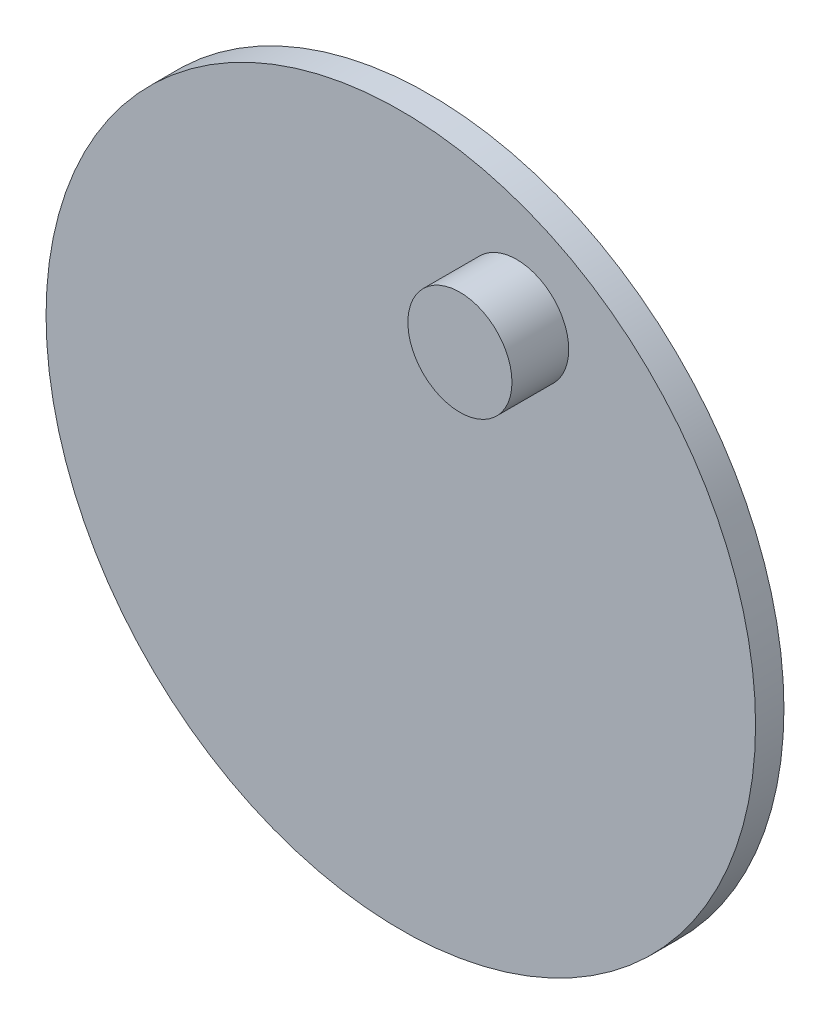
from build123d import *

# Parameters (mm, degrees)
SKETCH1_R           = 75
BOSS_EXTRUDE3_DEPTH = 6
SKETCH5_R           = 11
BOSS_EXTRUDE4_DEPTH = 12


with BuildPart() as part:
    # Sketch1 → Boss-Extrude3 (new body)
    with BuildSketch(Plane.XY):
        Circle(SKETCH1_R)
    extrude(amount=BOSS_EXTRUDE3_DEPTH)

    # Sketch5 → Boss-Extrude4 (add)
    with BuildSketch(Plane.XY.offset(6)):
        with Locations((24.495317404, 48.990634808)):
            Circle(SKETCH5_R)
    extrude(amount=BOSS_EXTRUDE4_DEPTH)


solid = part.part
